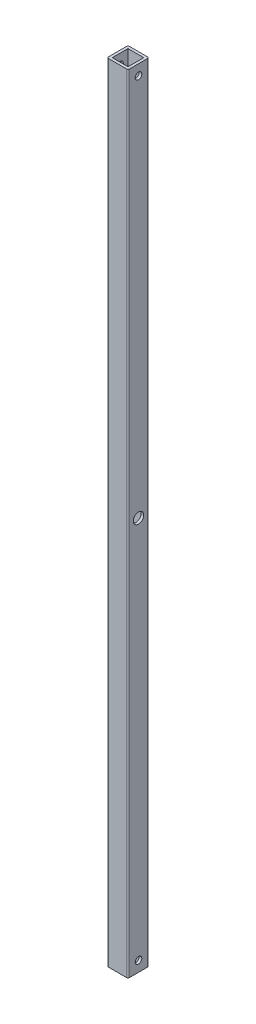
from build123d import *

# Parameters (mm, degrees)
SKETCH1_W           = 16
SKETCH1_H           = 16
SKETCH1_W_2         = 12
SKETCH1_H_2         = 12
BOSS_EXTRUDE1_DEPTH = 600
FILLET1_R           = 1
SKETCH2_R           = 4
CUT_EXTRUDE1_DEPTH  = 16
SKETCH6_R           = 2.5
CUT_EXTRUDE3_DEPTH  = 20


with BuildPart() as part:
    # Sketch1 → Boss-Extrude1 (new body)
    with BuildSketch(Plane(origin=(0, 0, 0), x_dir=(1, 0, 0), z_dir=(0, 1, 0))):
        with Locations((-0.34375, -3.28125)):
            Rectangle(SKETCH1_W, SKETCH1_H)
        with Locations((-0.34375, -3.28125)):
            Rectangle(SKETCH1_W_2, SKETCH1_H_2, mode=Mode.SUBTRACT)
    extrude(amount=BOSS_EXTRUDE1_DEPTH)

    # Fillet1
    fillet1_edges = [part.edges().sort_by_distance(p)[0] for p in [
        (-8.34375, 300, -4.71875),
        (7.65625, 300, -4.71875),
        (7.65625, 300, 11.28125),
        (-8.34375, 300, 11.28125),
    ]]
    fillet(fillet1_edges, radius=FILLET1_R)

    # Sketch2 → Cut-Extrude1 (cut)
    with BuildSketch(Plane.ZY.offset(8.34375)):
        with Locations((3.28125, 300)):
            Circle(SKETCH2_R)
    extrude(amount=-CUT_EXTRUDE1_DEPTH, mode=Mode.SUBTRACT)

    # Sketch6 → Cut-Extrude3 (cut)
    with BuildSketch(Plane.ZY.offset(8.34375)):
        with Locations((3.28125, 8)):
            Circle(SKETCH6_R)
        with Locations((3.28125, 592)):
            Circle(SKETCH6_R)
    extrude(amount=-CUT_EXTRUDE3_DEPTH, mode=Mode.SUBTRACT)


solid = part.part
